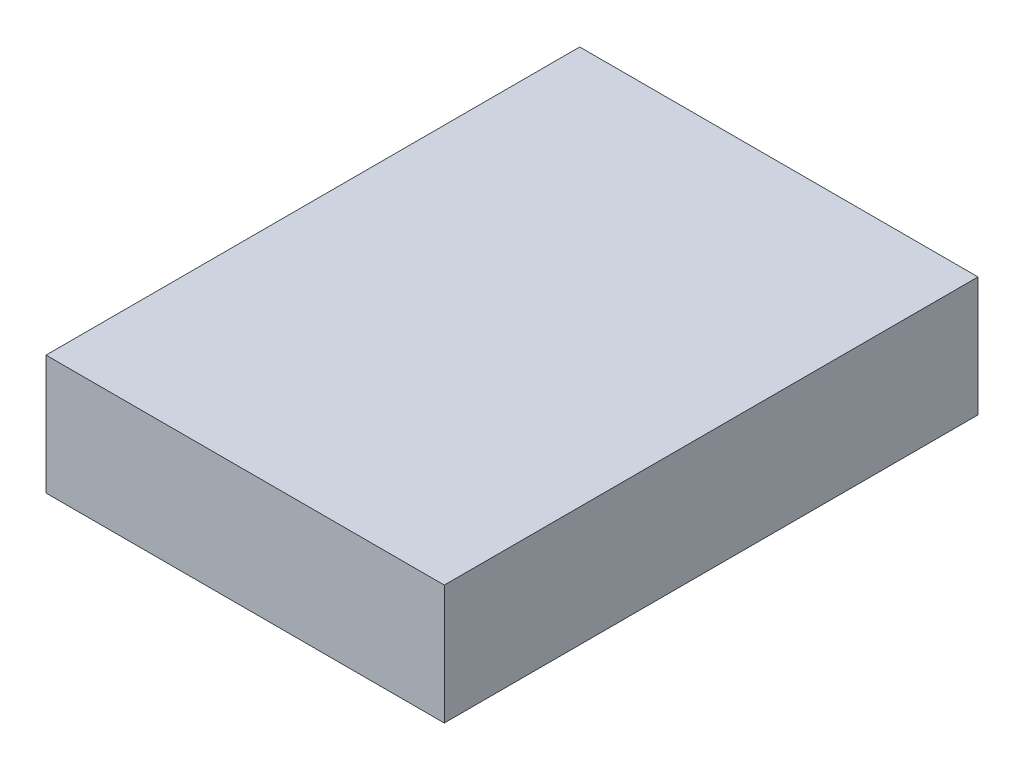
from build123d import *

# Parameters (mm, degrees)
SKETCH1_W           = 50
SKETCH1_H           = 67
BOSS_EXTRUDE1_DEPTH = 15


with BuildPart() as part:
    # Sketch1 → Boss-Extrude1 (new body)
    with BuildSketch(Plane(origin=(0, 0, 0), x_dir=(1, 0, 0), z_dir=(0, 1, 0))):
        Rectangle(SKETCH1_W, SKETCH1_H)
    extrude(amount=BOSS_EXTRUDE1_DEPTH)


solid = part.part
